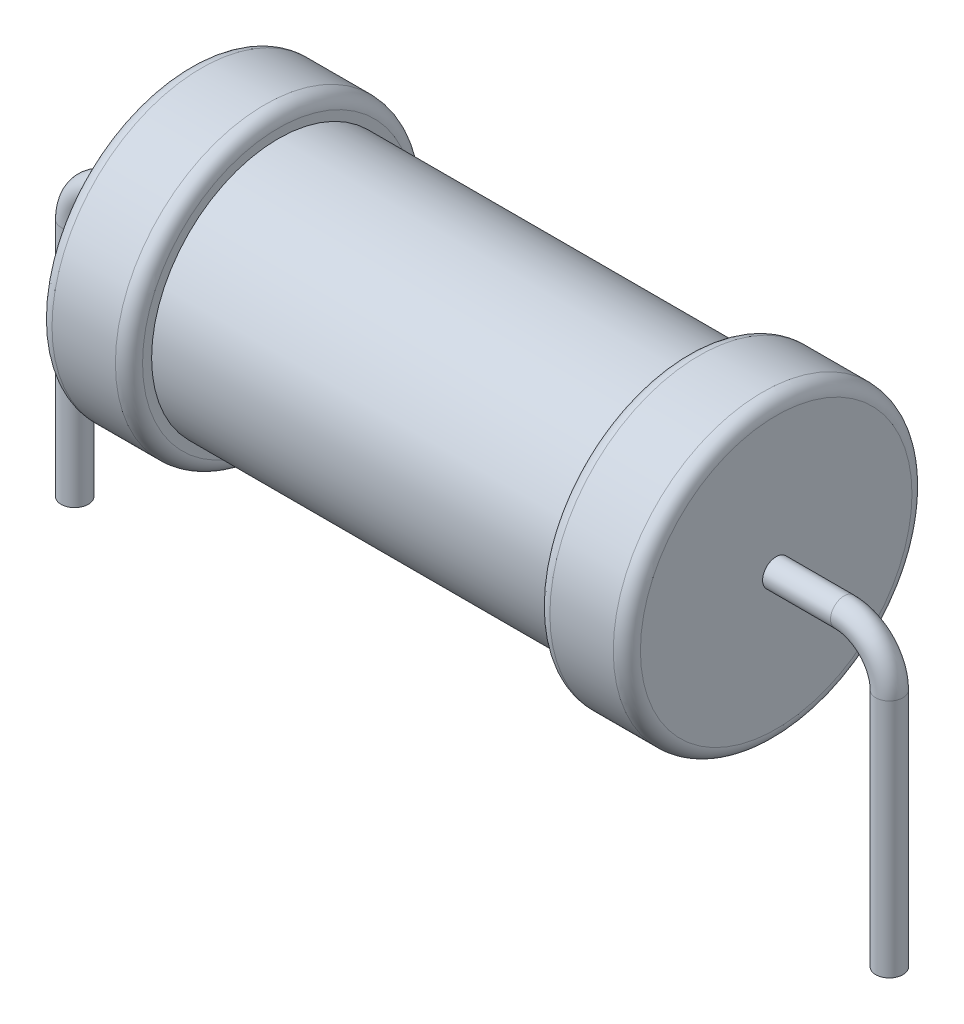
from build123d import *

# Parameters (mm, degrees)
SKETCH_3_R = 0.3
FILLET_1_R = 0.3


with BuildPart() as part:
    # Эскиз1 → Повернуть1 (revolve)
    with BuildSketch(Plane.XY, mode=Mode.PRIVATE) as revolve_1_sk:
        Polygon((0, 0), (0, 3.3), (2, 3.3), (2, 2.8), (11, 2.8), (11, 3.3), (13, 3.3), (13, 0), align=None)
    revolve(revolve_1_sk.sketch.rotate(Axis((0, 0, 0), (1, 0, 0)), 90), axis=Axis((0, 0, 0), (1, 0, 0)))

    # По траектории1: sweep along a path in Эскиз2
    with BuildLine(Plane.XY) as sweep_1_path:
        Line((-2.5, -6.3), (-2.5, -1))
        ThreePointArc((-2.5, -1), (-2.207106781, -0.292893219), (-1.5, 0))
        Line((-1.5, 0), (14.5, 0))
        ThreePointArc((14.5, 0), (15.207106781, -0.292893219), (15.5, -1))
        Line((15.5, -1), (15.5, -6.3))
    # Эскиз3 → По траектории1 (sweep)
    with BuildSketch(Plane(origin=(-2.5, -6.3, 0), x_dir=(-1, 0, 0), z_dir=(0, 1, 0))):
        Circle(SKETCH_3_R)
    sweep(path=sweep_1_path.line)

    # Скругление1
    fillet_1_edges = [part.edges().sort_by_distance(p)[0] for p in [
        (13, 0, -3.3),
        (11, 0, -3.3),
        (2, 0, -3.3),
        (0, 0, -3.3),
    ]]
    fillet(fillet_1_edges, radius=FILLET_1_R)


solid = part.part
